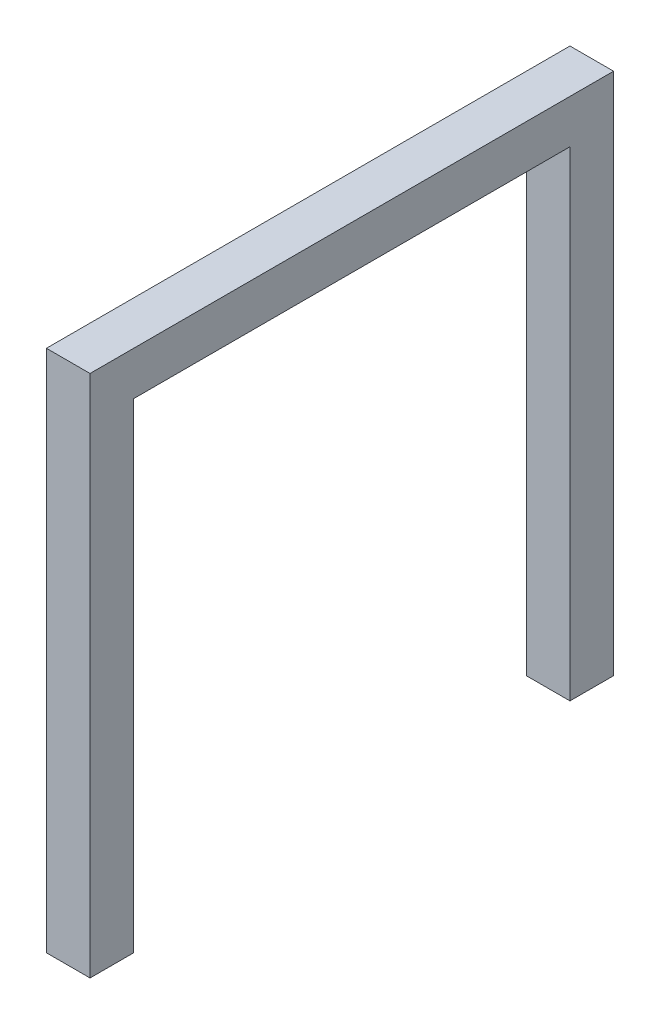
from build123d import *

# Parameters (mm, degrees)
SKETCH1_W               = 50
SKETCH1_H               = 600
BOSS_EXTRUDE1_DEPTH     = 300
CUT_EXTRUDE1_DEPTH      = 428.200187266
CUT_EXTRUDE1_DEPTH_BACK = 428.200187266
SKETCH2_W               = 500
SKETCH2_H               = 550


with BuildPart() as part:
    # Sketch1 → Boss-Extrude1 (new, symmetric)
    with BuildSketch(Plane.XY):
        Rectangle(SKETCH1_W, SKETCH1_H)
    extrude(amount=BOSS_EXTRUDE1_DEPTH, both=True)

    # Sketch2 → Cut-Extrude1 (cut, two sides: drawn at the far end of the back side and taken through both)
    with BuildSketch(Plane(origin=(25, 0, 0), x_dir=(0, 0, -1), z_dir=(1, 0, 0)).offset(-CUT_EXTRUDE1_DEPTH_BACK)):
        with Locations((0, -25)):
            Rectangle(SKETCH2_W, SKETCH2_H)
    extrude(amount=CUT_EXTRUDE1_DEPTH + CUT_EXTRUDE1_DEPTH_BACK, mode=Mode.SUBTRACT)


solid = part.part
